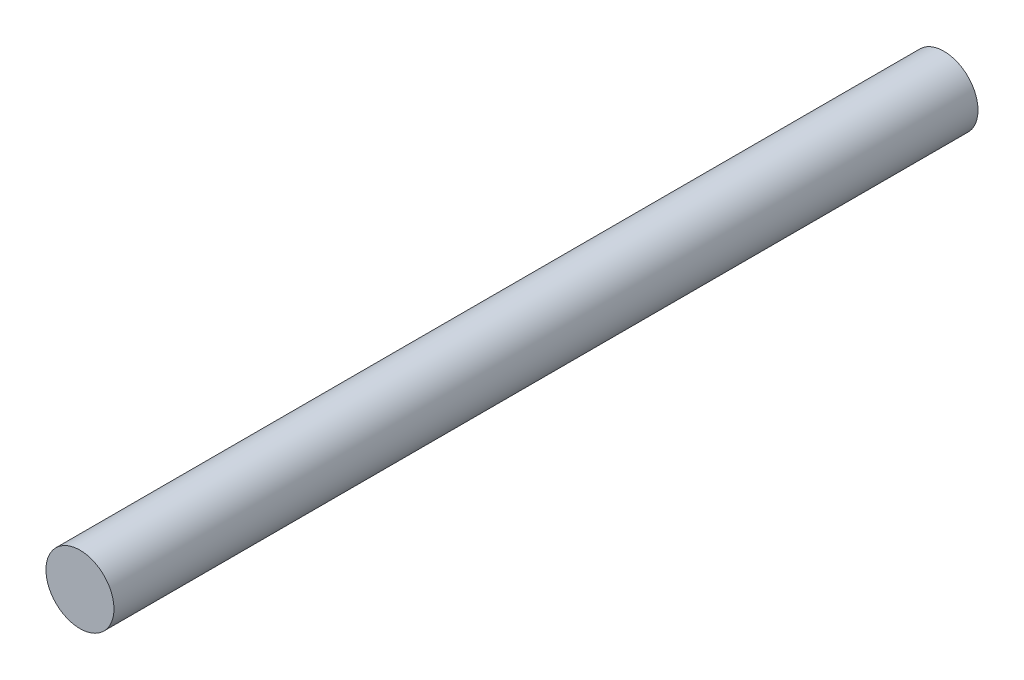
from build123d import *

# Parameters (mm, degrees)
SKETCH4_R           = 4.5
BOSS_EXTRUDE4_DEPTH = 114.3


with BuildPart() as part:
    # Sketch4 → Boss-Extrude4 (new body)
    with BuildSketch(Plane.XY.offset(88.9)):
        Circle(SKETCH4_R)
    extrude(amount=-BOSS_EXTRUDE4_DEPTH)


solid = part.part
